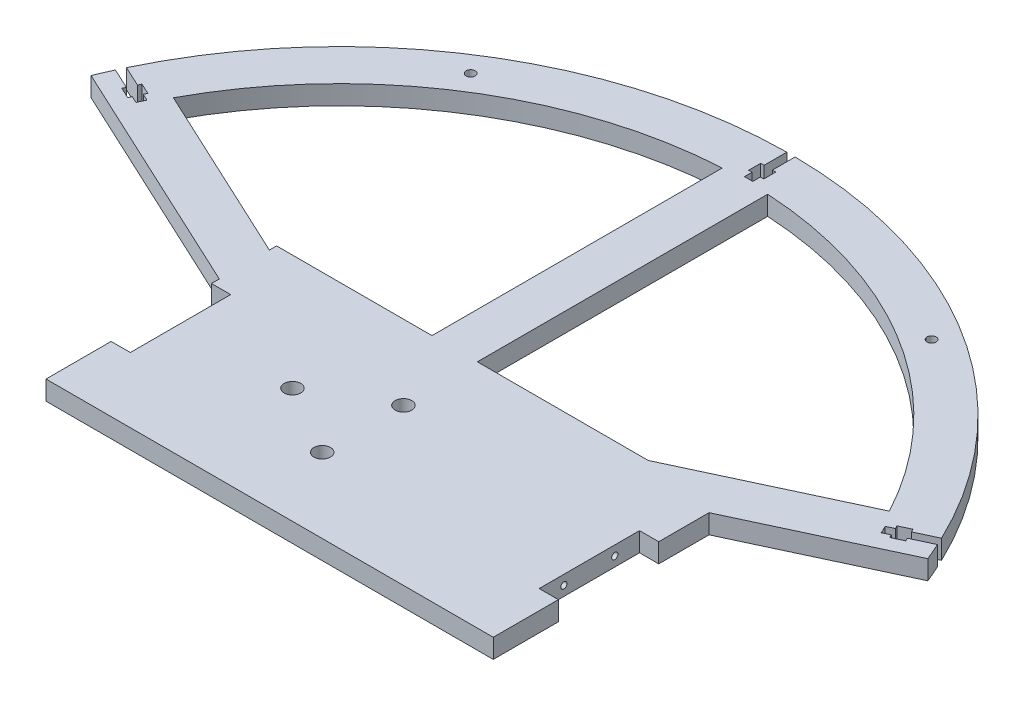
from build123d import *

# Parameters (mm, degrees)
BOSS_EXTRUDE1_DEPTH               = 3.175
SKETCH2_W                         = 2.75
SKETCH2_H                         = 2.5
SKETCH2_H_2                       = 4
SKETCH2_W_2                       = 1.125
SKETCH2_H_3                       = 7.5
CUT_EXTRUDE1_DEPTH                = 204.460831631
CIRPATTERN1_COUNT                 = 2
CIRPATTERN1_ANGLE                 = 65
CIRPATTERN1_THE_OTHER_WAY_COUNT   = 2
CIRPATTERN1_THE_OTHER_WAY_ANGLE   = 65
F_3_0_3_DIAMETER_HOLE1_D          = 3
M5_CLEARANCE_HOLE1_D              = 5.5
SKETCH9_W                         = 6.35
SKETCH9_H                         = 33.16
CUT_EXTRUDE2_DEPTH                = 204.530492207
M2_5X0_45_TAPPED_HOLE1_AT_2_COUNT = 2
M2_5X0_45_TAPPED_HOLE1_AT_2_PITCH = 16.83


with BuildPart() as part:
    # Sketch1 → Boss-Extrude1 (new, symmetric)
    with BuildSketch(Plane(origin=(0, 0, 0), x_dir=(1, 0, 0), z_dir=(0, 1, 0))):
        with BuildLine():
            Line((88.95, 33.202731801), (138.254290129, 56.193699868))
            ThreePointArc((138.254290129, 56.193699868), (0, 149.238), (-138.254290129, 56.193699868))
            Line((-138.254290129, 56.193699868), (-58.85, 19.16687129))
            Line((-58.85, 19.16687129), (-58.85, -38.1))
            Line((-58.85, -38.1), (88.95, -38.1))
            Line((88.95, -38.1), (88.95, 33.202731801))
        make_face()
        with BuildLine():
            Line((-7.5, 11.821590418), (-7.5, 11.772641828))
            Line((-7.5, 11.772641828), (-7.544362488, 11.793328396))
            ThreePointArc((-7.544362488, 11.793328396), (-7.522194517, 11.807480241), (-7.5, 11.821590418))
        make_face(mode=Mode.SUBTRACT)
        with BuildLine():
            ThreePointArc((7.5, 11.821590418), (7.522194517, 11.807480241), (7.544362488, 11.793328396))
            Line((7.544362488, 11.793328396), (7.5, 11.772641828))
            Line((7.5, 11.772641828), (7.5, 11.821590418))
        make_face(mode=Mode.SUBTRACT)
        with BuildLine():
            Line((-7.5, 134.028320306), (-7.5, 38.1))
            Line((-7.5, 38.1), (-58.85, 38.1))
            Line((-58.85, 38.1), (-58.85, 35.717540075))
            Line((-58.85, 35.717540075), (-118.301273414, 63.440124154))
            ThreePointArc((-118.301273414, 63.440124154), (-72.126024825, 113.215180903), (-7.5, 134.028320306))
        make_face(mode=Mode.SUBTRACT)
        with BuildLine():
            ThreePointArc((7.5, 134.028320306), (72.126024825, 113.215180903), (118.301273414, 63.440124154))
            Line((118.301273414, 63.440124154), (63.959201798, 38.1))
            Line((63.959201798, 38.1), (7.5, 38.1))
            Line((7.5, 38.1), (7.5, 134.028320306))
        make_face(mode=Mode.SUBTRACT)
    extrude(amount=BOSS_EXTRUDE1_DEPTH, both=True)

    # Sketch2 → Cut-Extrude1 (cut, symmetric)
    with BuildSketch(Plane(origin=(0, 0, 0), x_dir=(1, 0, 0), z_dir=(0, 1, 0))):
        with Locations((0, 136.488)):
            Rectangle(SKETCH2_W, SKETCH2_H)
        with Locations((0, 139.738)):
            Rectangle(SKETCH2_W, SKETCH2_H_2)
        with Locations((1.9375, 139.738)):
            Rectangle(SKETCH2_W_2, SKETCH2_H_2)
        with Locations((0, 145.488)):
            Rectangle(SKETCH2_W, SKETCH2_H_3)
        with Locations((-1.9375, 139.738)):
            Rectangle(SKETCH2_W_2, SKETCH2_H_2)
    cut_extrude1 = extrude(amount=CUT_EXTRUDE1_DEPTH, both=True, mode=Mode.SUBTRACT)

    # CirPattern1: Cut-Extrude1 ×2 about axis
    cirpattern1_axis = Axis((0, 0, 0), (0, 1, 0))
    for i in range(1, CIRPATTERN1_COUNT):
        add(cut_extrude1.rotate(cirpattern1_axis, i * CIRPATTERN1_ANGLE / (CIRPATTERN1_COUNT - 1)), mode=Mode.SUBTRACT)

    # CirPattern1 the other way: Cut-Extrude1 ×2 about axis
    cirpattern1_the_other_way_axis = Axis((0, 0, 0), (0, -1, 0))
    for i in range(1, CIRPATTERN1_THE_OTHER_WAY_COUNT):
        add(cut_extrude1.rotate(cirpattern1_the_other_way_axis, i * CIRPATTERN1_THE_OTHER_WAY_ANGLE / (CIRPATTERN1_THE_OTHER_WAY_COUNT - 1)), mode=Mode.SUBTRACT)

    # Ø3.0 (3) Diameter Hole1 (through all)
    with Locations(Plane(origin=(0, 3.175, 0), x_dir=(1, 0, 0), z_dir=(0, 1, 0))):
        with Locations((76.155771888, 119.540616747), (-76.155771888, 119.540616747)):
            Hole(F_3_0_3_DIAMETER_HOLE1_D / 2)

    # M5 Clearance Hole1 (through all)
    with Locations(Plane(origin=(0, 3.175, 0), x_dir=(1, 0, 0), z_dir=(0, 1, 0))):
        with Locations((-15.5, 0), (7.75, 13.423393759), (7.75, -13.423393759)):
            Hole(M5_CLEARANCE_HOLE1_D / 2)

    # Sketch9 → Cut-Extrude2 (cut, through all)
    with BuildSketch(Plane(origin=(0, 3.175, 0), x_dir=(1, 0, 0), z_dir=(0, 1, 0))):
        with Locations((-55.675, 0)):
            Rectangle(SKETCH9_W, SKETCH9_H)
        with Locations((85.775, 0)):
            Rectangle(SKETCH9_W, SKETCH9_H)
    extrude(amount=-CUT_EXTRUDE2_DEPTH, mode=Mode.SUBTRACT)

    # Sketch11 → M2.5x0.45 Tapped Hole1 (revolve, cut)
    with BuildSketch(Plane(origin=(-52.5, 0, -8.415), x_dir=(0, 0, 1), z_dir=(0, 1, 0))):
        Polygon((0, 0), (0, 6.965882135), (1.025, 6.35), (1.025, 0), align=None)
    m2_5x0_45_tapped_hole1 = revolve(axis=Axis((-58.85, 0, -8.415), (1, 0, 0)), mode=Mode.SUBTRACT)

    # M2.5x0.45 Tapped Hole1 at 2: M2.5x0.45 Tapped Hole1 ×2
    with Locations(*[(0, 0, i * M2_5X0_45_TAPPED_HOLE1_AT_2_PITCH) for i in range(1, M2_5X0_45_TAPPED_HOLE1_AT_2_COUNT)]):
        add(m2_5x0_45_tapped_hole1, mode=Mode.SUBTRACT)

    # Mirror1: M2.5x0.45 Tapped Hole1 across plane
    add(m2_5x0_45_tapped_hole1.mirror(Plane.ZY.offset(-15.05)), mode=Mode.SUBTRACT)

    # Mirror1 copy 1 sketch → Mirror1 copy 1 (revolve, cut)
    with BuildSketch(Plane(origin=(82.6, 0, 8.415), x_dir=(0, 0, 1), z_dir=(0, 1, 0))):
        Polygon((0, 0), (0, -6.965882135), (1.025, -6.35), (1.025, 0), align=None)
    revolve(axis=Axis((88.95, 0, 8.415), (1, 0, 0)), mode=Mode.SUBTRACT)


solid = part.part
